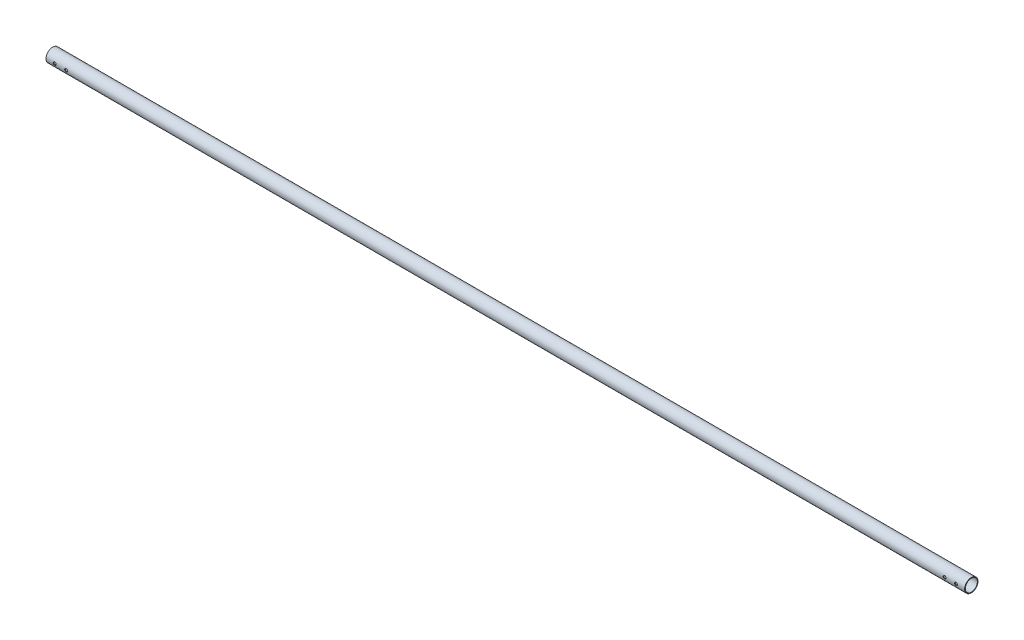
from build123d import *

# Parameters (mm, degrees)
SKETCH1_R           = 14.7701
SKETCH1_R_2         = 13.3223
BOSS_EXTRUDE1_DEPTH = 2032
SKETCH2_R           = 3.175
CUT_EXTRUDE1_DEPTH  = 2033.107357328


with BuildPart() as part:
    # Sketch1 → Boss-Extrude1 (new body)
    with BuildSketch(Plane(origin=(0, 0, 0), x_dir=(0, 0, -1), z_dir=(1, 0, 0))):
        Circle(SKETCH1_R)
        Circle(SKETCH1_R_2, mode=Mode.SUBTRACT)
    extrude(amount=BOSS_EXTRUDE1_DEPTH)

    # Sketch2 → Cut-Extrude1 (cut, symmetric)
    with BuildSketch(Plane.XY):
        with Locations((19.05, 0)):
            Circle(SKETCH2_R)
        with Locations((44.45, 0)):
            Circle(SKETCH2_R)
    cut_extrude1 = extrude(amount=CUT_EXTRUDE1_DEPTH, both=True, mode=Mode.SUBTRACT)

    # Mirror1: Cut-Extrude1 across plane
    add(cut_extrude1.mirror(Plane(origin=(1016, 0, 0), x_dir=(0, 0, 1), z_dir=(1, 0, 0))), mode=Mode.SUBTRACT)


solid = part.part
